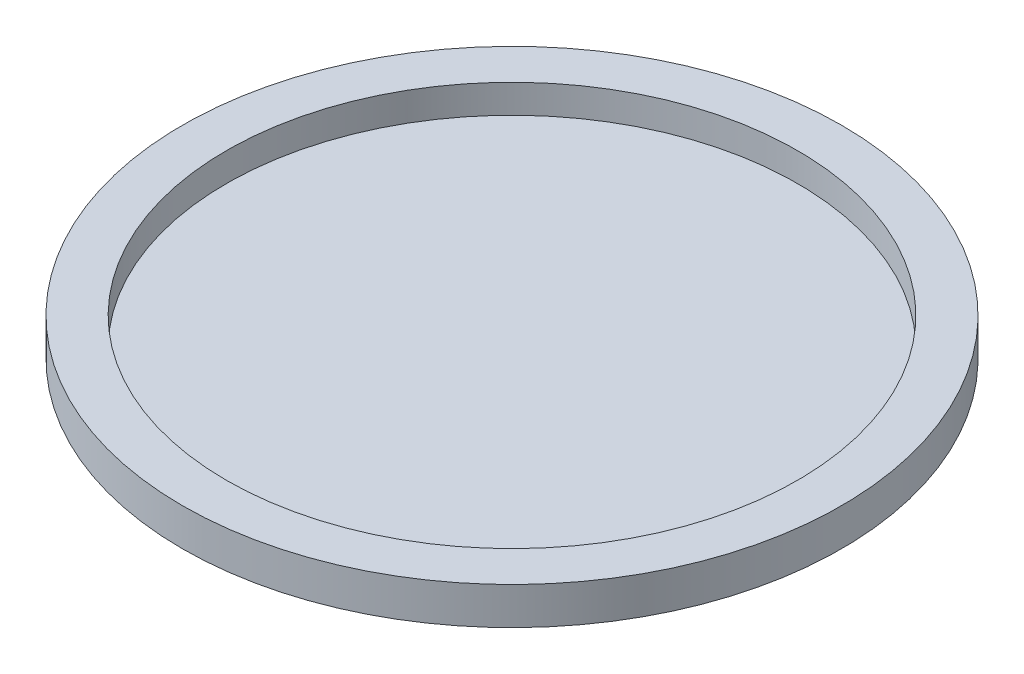
from build123d import *

# Parameters (mm, degrees)
SKETCH_1_R          = 15
EXTRUDE_1_DEPTH     = 1.7
SKETCH_2_R          = 13.403606185
EXTRUDE_2_DEPTH     = 1.2
FILLET_1_R          = 1
SKETCH_4_R          = 7.153275754
EXTRUDE_3_DEPTH     = 2.1
SKETCH_6_R          = 12.998633497
CUT_EXTRUDE_4_DEPTH = 1.3


with BuildPart() as part:
    # Эскиз1 → Бобышка-Вытянуть1 (new body)
    with BuildSketch(Plane(origin=(0, 0, 0), x_dir=(1, 0, 0), z_dir=(0, 1, 0))):
        with Locations(Location((0, 0, 0), (0, 0, 270))):
            Circle(SKETCH_1_R)
    extrude(amount=EXTRUDE_1_DEPTH)

    # Эскиз2 → Бобышка-Вытянуть2 (add)
    with BuildSketch(Plane.XZ):
        with Locations(Location((0, 0, 0), (0, 0, 90))):
            Circle(SKETCH_2_R)
    extrude(amount=EXTRUDE_2_DEPTH)

    # Скругление1
    fillet_1_edges = [part.edges().sort_by_distance(p)[0] for p in [
        (0, -1.2, -13.403606185),
    ]]
    fillet(fillet_1_edges, radius=FILLET_1_R)

    # Эскиз4 → Бобышка-Вытянуть3 (add)
    with BuildSketch(Plane.XZ.offset(1.2)):
        with Locations(Location((0, 0, 0), (0, 0, 270))):
            Circle(SKETCH_4_R)
    extrude(amount=EXTRUDE_3_DEPTH)

    # Эскиз6 → Вырез-Вытянуть4 (cut)
    with BuildSketch(Plane(origin=(0, 1.7, 0), x_dir=(1, 0, 0), z_dir=(0, 1, 0))):
        with Locations(Location((0, 0, 0), (0, 0, 270))):
            Circle(SKETCH_6_R)
    extrude(amount=-CUT_EXTRUDE_4_DEPTH, mode=Mode.SUBTRACT)


solid = part.part
